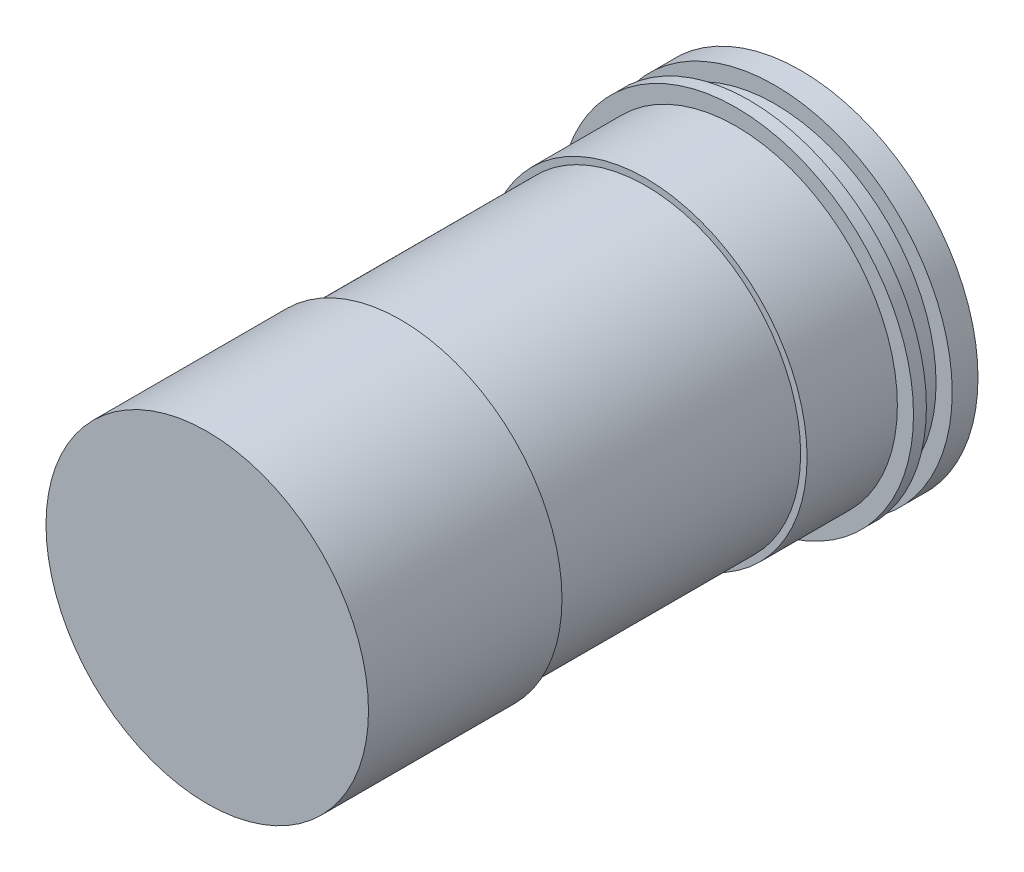
from build123d import *

# Parameters (mm, degrees)
SKETCH1_R           = 12.5
BOSS_EXTRUDE1_DEPTH = 3.5
SKETCH5_R           = 9.75
CUT_EXTRUDE2_DEPTH  = 5
CUT_EXTRUDE2_DRAFT  = -45


with BuildPart() as part:
    # Sketch1 → Boss-Extrude1 (new, symmetric)
    with BuildSketch(Plane.XY):
        Circle(SKETCH1_R)
    extrude(amount=BOSS_EXTRUDE1_DEPTH, both=True)

    # Sketch4 → Revolve1 (revolve)
    with BuildSketch(Plane(origin=(0, 0, 0), x_dir=(1, 0, 0), z_dir=(0, 1, 0)), mode=Mode.PRIVATE) as revolve1_sk:
        Polygon((-12.5, 3.5), (0, 3.5), (0, 42.5), (-13.75, 42.5), (-13.75, 40.5), (-12.5, 40.5), (-12.5, 38.5), (-13.75, 38.5), (-13.75, 37.5), (-12.5, 37.5), (-12.5, 30.5), (-12, 30.5), (-12, 11.5), (-12.5, 11.5), align=None)
    revolve(revolve1_sk.sketch.rotate(Axis((0, 0, -3.5), (0, 0, -1)), 180), axis=Axis((0, 0, -3.5), (0, 0, -1)))


with BuildPart() as cut_extrude2_tool:
    # Sketch5 → Cut-Extrude2 (with draft: the straight prism first)
    with BuildSketch(Plane(origin=(0, 0, -42.5), x_dir=(-1, 0, 0), z_dir=(0, 0, -1))):
        Circle(SKETCH5_R)
    extrude(amount=-CUT_EXTRUDE2_DEPTH)
    # Cut-Extrude2: the draft: its side faces are tilted about the plane it starts from
    cut_extrude2_sides = [cut_extrude2_tool.faces().sort_by_distance(p)[0] for p in [
        (9.75, 0, -40),
    ]]
    draft(cut_extrude2_sides, Plane(origin=(0, 0, -42.5), x_dir=(-1, 0, 0), z_dir=(0, 0, -1)), CUT_EXTRUDE2_DRAFT)


with BuildPart() as part_1:
    add(part.part)

    # Cut-Extrude2: cut by cut_extrude2_tool
    add(cut_extrude2_tool.part, mode=Mode.SUBTRACT)

    # Sketch6 → Revolve2 (revolve)
    with BuildSketch(Plane(origin=(0, 0, 0), x_dir=(1, 0, 0), z_dir=(0, 1, 0))):
        with BuildLine():
            Line((-4.75, 37.5), (0, 37.5))
            Line((0, 37.5), (0, 42.25))
            ThreePointArc((0, 42.25), (-3.358757211, 40.858757211), (-4.75, 37.5))
        make_face()
    revolve(axis=Axis((0, 0, -37.5), (0, 0, -1)))


solid = part_1.part
